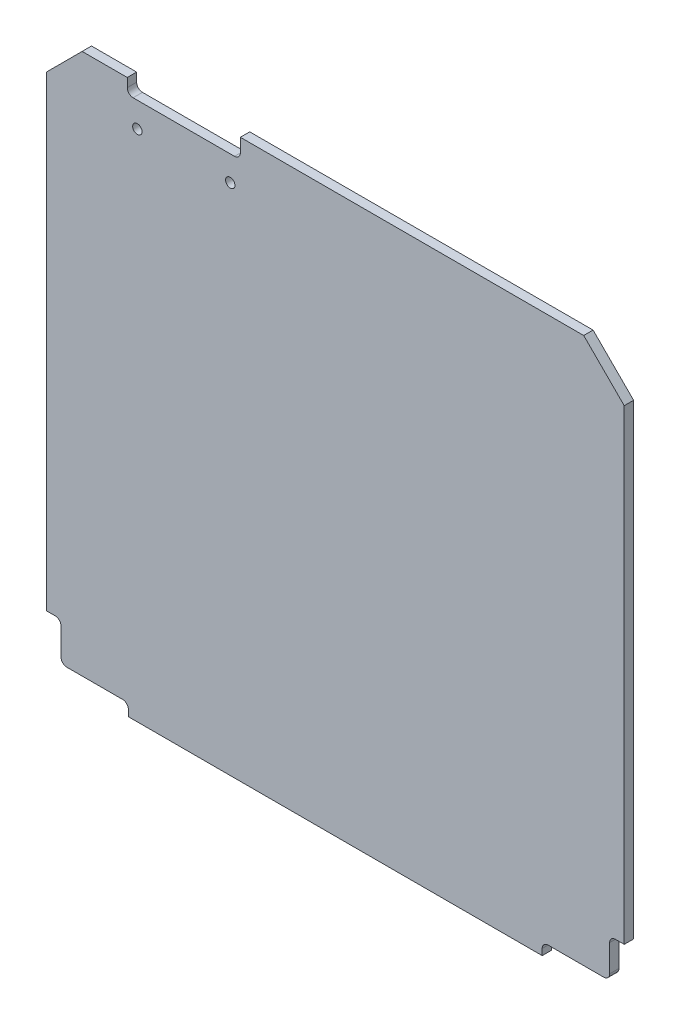
from build123d import *

# Parameters (mm, degrees)
SKETCH1_R           = 0.8
BOSS_EXTRUDE1_DEPTH = 1.6


with BuildPart() as part:
    # Sketch1 → Boss-Extrude1 (new body)
    with BuildSketch(Plane.XY.offset(1.5875)):
        with BuildLine():
            Line((-35.3, -48), (-35.3, -49.065))
            Line((-35.3, -49.065), (35.3, -49.065))
            Line((35.3, -49.065), (35.3, -48))
            ThreePointArc((35.3, -48), (35.592893219, -47.292893219), (36.3, -47))
            Line((36.3, -47), (45.8, -47))
            ThreePointArc((45.8, -47), (46.507106781, -46.707106781), (46.8, -46))
            Line((46.8, -46), (46.8, -41.4))
            ThreePointArc((46.8, -41.4), (47.092893219, -40.692893219), (47.8, -40.4))
            Line((47.8, -40.4), (49.3, -40.4))
            Line((49.3, -40.4), (49.3, 39.2))
            Line((49.3, 39.2), (42.385, 46.115))
            Line((42.385, 46.115), (-16.200000009, 46.115))
            Line((-16.200000009, 46.115), (-16.200000009, 43.8))
            ThreePointArc((-16.200000009, 43.8), (-16.492893227, 43.092893219), (-17.200000009, 42.8))
            Line((-17.200000009, 42.8), (-34.500000017, 42.8))
            ThreePointArc((-34.500000017, 42.8), (-35.207106799, 43.092893219), (-35.500000017, 43.8))
            Line((-35.500000017, 43.8), (-35.500000017, 45.3))
            Line((-35.500000017, 45.3), (-43.2, 45.3))
            Line((-43.2, 45.3), (-49.3, 39.2))
            Line((-49.3, 39.2), (-49.3, -40.4))
            Line((-49.3, -40.4), (-47.8, -40.4))
            ThreePointArc((-47.8, -40.4), (-47.092893219, -40.692893219), (-46.8, -41.4))
            Line((-46.8, -41.4), (-46.8, -46))
            ThreePointArc((-46.8, -46), (-46.507106781, -46.707106781), (-45.8, -47))
            Line((-45.8, -47), (-36.3, -47))
            ThreePointArc((-36.3, -47), (-35.592893219, -47.292893219), (-35.3, -48))
        make_face()
        with Locations(Location((-17.925000017, 38.540608, 0), (0, 0, 180))):
            Circle(SKETCH1_R, mode=Mode.SUBTRACT)
        with Locations(Location((-33.775, 38.54, 0), (0, 0, 180))):
            Circle(SKETCH1_R, mode=Mode.SUBTRACT)
    extrude(amount=-BOSS_EXTRUDE1_DEPTH)


solid = part.part
